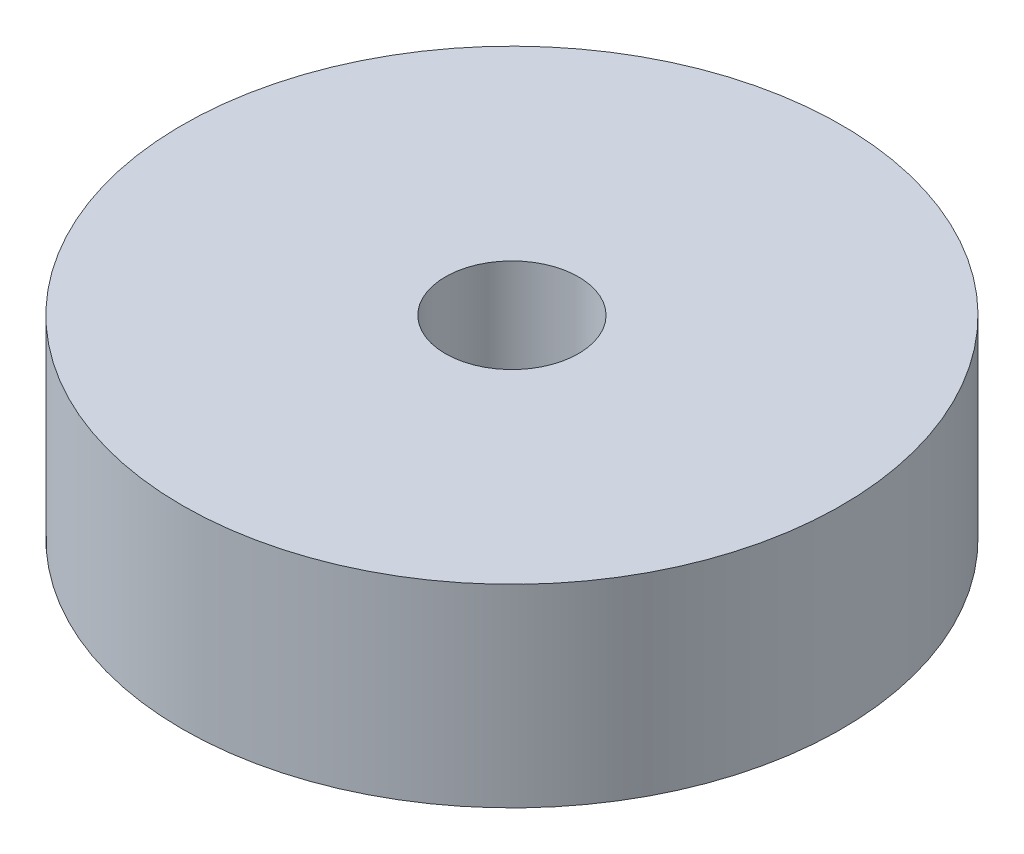
from build123d import *

# Parameters (mm, degrees)
SKETCH1_R           = 9.9
SKETCH1_R_2         = 2
BOSS_EXTRUDE1_DEPTH = 5.8166


with BuildPart() as part:
    # Sketch1 → Boss-Extrude1 (new body)
    with BuildSketch(Plane(origin=(0, 0, 0), x_dir=(1, 0, 0), z_dir=(0, 1, 0))):
        with Locations(Location((0, 0, 0), (0, 0, 270))):
            Circle(SKETCH1_R)
        with Locations(Location((0, 0, 0), (0, 0, 270))):
            Circle(SKETCH1_R_2, mode=Mode.SUBTRACT)
    extrude(amount=BOSS_EXTRUDE1_DEPTH)


solid = part.part
